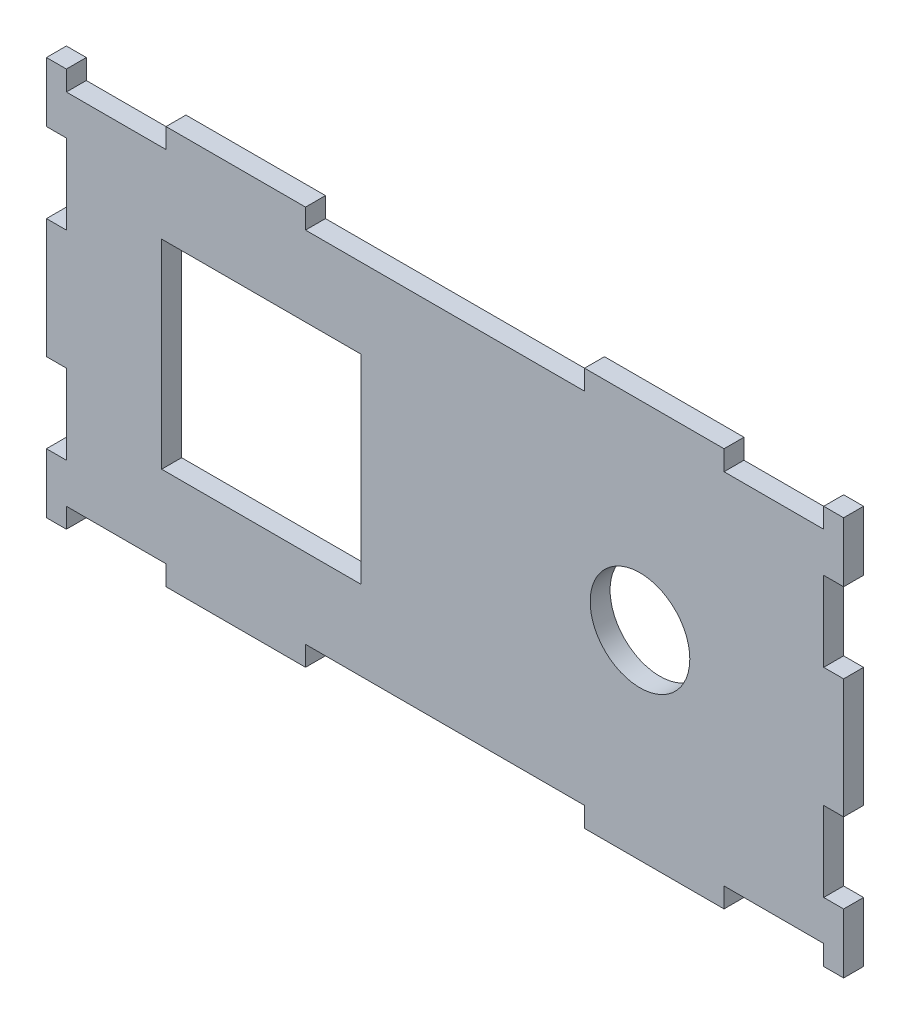
from build123d import *

# Parameters (mm, degrees)
ESQUISSE1_R        = 12.5
ESQUISSE1_W        = 50
ESQUISSE1_H        = 50
BOSS_EXTRU_1_DEPTH = 5


with BuildPart() as part:
    # Esquisse1 → Boss.-Extru.1 (new body)
    with BuildSketch(Plane.XY):
        Polygon((-28.909774436, 20), (-23.909774436, 20), (-23.909774436, 15), (1.090225564, 15), (1.090225564, 20), (36.090225564, 20), (36.090225564, 15), (106.090225564, 15), (106.090225564, 20), (141.090225564, 20), (141.090225564, 15), (166.090225564, 15), (166.090225564, 20), (171.090225564, 20), (171.090225564, 5.001724715), (166.090225564, 5.001724715), (166.090225564, -14.998275285), (171.090225564, -14.998275285), (171.090225564, -44.998275285), (166.090225564, -44.998275285), (166.090225564, -64.998275285), (171.090225564, -64.998275285), (171.090225564, -79.99655057), (166.090225564, -79.99655057), (166.090225564, -74.99655057), (141.090225564, -74.99655057), (141.090225564, -79.99655057), (106.090225564, -79.99655057), (106.090225564, -74.99655057), (36.090225564, -74.99655057), (36.090225564, -79.99655057), (1.090225564, -79.99655057), (1.090225564, -74.99655057), (-23.909774436, -74.99655057), (-23.909774436, -79.99655057), (-28.909774436, -79.99655057), (-28.909774436, -64.998275285), (-23.909774436, -64.998275285), (-23.909774436, -59.99655057), (-23.909774436, -44.998275285), (-28.909774436, -44.998275285), (-28.909774436, -14.998275285), (-23.909774436, -14.998275285), (-23.909774436, 5), (-28.909774436, 5), align=None)
        with Locations((120, -29.998275285)):
            Circle(ESQUISSE1_R, mode=Mode.SUBTRACT)
        with Locations((25, -29.998275285)):
            Rectangle(ESQUISSE1_W, ESQUISSE1_H, mode=Mode.SUBTRACT)
    extrude(amount=BOSS_EXTRU_1_DEPTH)


solid = part.part
